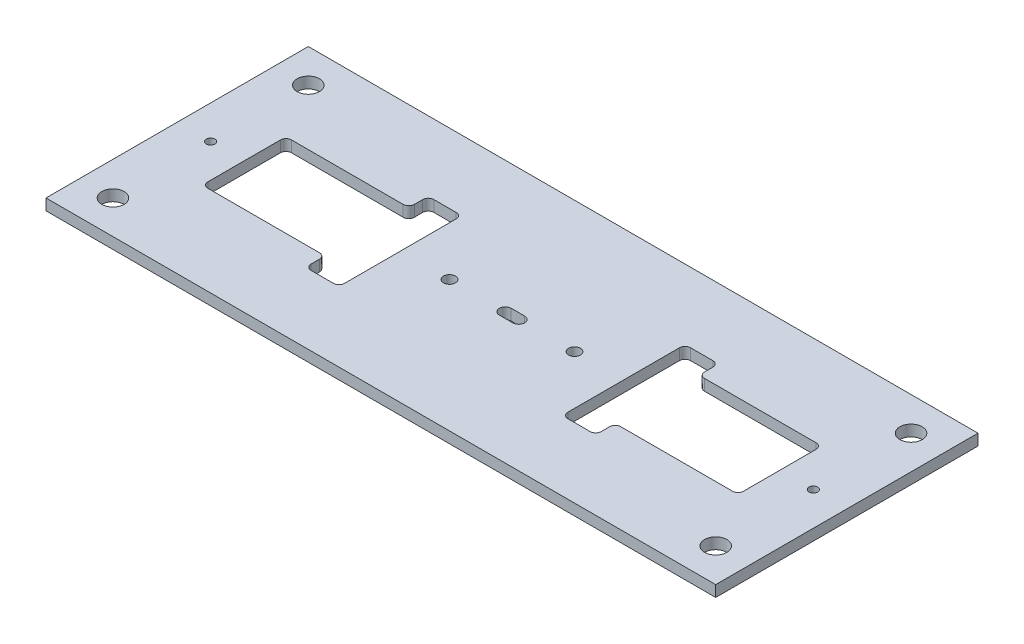
from build123d import *

# Parameters (mm, degrees)
SKETCH1_W                    = 381
SKETCH1_H                    = 149.225
BOSS_EXTRUDE1_DEPTH          = 6.35
F_1_4_CLEARANCE_HOLE1_D      = 6.7564
CUT_EXTRUDE1_DEPTH           = 410.23028129
F_1_2_0_5_DIAMETER_HOLE1_D   = 12.7
F_10_0_1935_DIAMETER_HOLE1_D = 4.9149
SKETCH9_W                    = 19.05
SKETCH9_H                    = 14.2875
CUT_EXTRUDE2_DEPTH           = 410.23028129
FILLET1_R                    = 3.175


with BuildPart() as part:
    # Sketch1 → Boss-Extrude1 (new body)
    with BuildSketch(Plane(origin=(0, 0, 0), x_dir=(1, 0, 0), z_dir=(0, 1, 0))):
        with Locations((190.5, 74.6125)):
            Rectangle(SKETCH1_W, SKETCH1_H)
        with BuildLine():
            Line((342.9, 95.25), (342.9, 53.975))
            ThreePointArc((342.9, 53.975), (341.97006403, 51.72993597), (339.725, 50.8))
            Line((339.725, 50.8), (257.175, 50.8))
            ThreePointArc((257.175, 50.8), (254.92993597, 51.72993597), (254, 53.975))
            Line((254, 53.975), (254, 95.25))
            ThreePointArc((254, 95.25), (254.92993597, 97.49506403), (257.175, 98.425))
            Line((257.175, 98.425), (339.725, 98.425))
            ThreePointArc((339.725, 98.425), (341.97006403, 97.49506403), (342.9, 95.25))
        make_face(mode=Mode.SUBTRACT)
        with BuildLine():
            Line((41.275, 98.425), (123.825, 98.425))
            ThreePointArc((123.825, 98.425), (126.07006403, 97.49506403), (127, 95.25))
            Line((127, 95.25), (127, 53.975))
            ThreePointArc((127, 53.975), (126.07006403, 51.72993597), (123.825, 50.8))
            Line((123.825, 50.8), (41.275, 50.8))
            ThreePointArc((41.275, 50.8), (39.02993597, 51.72993597), (38.1, 53.975))
            Line((38.1, 53.975), (38.1, 95.25))
            ThreePointArc((38.1, 95.25), (39.02993597, 97.49506403), (41.275, 98.425))
        make_face(mode=Mode.SUBTRACT)
    extrude(amount=BOSS_EXTRUDE1_DEPTH)

    # 1/4 Clearance Hole1 (through all)
    with Locations(Plane(origin=(0, 6.35, 0), x_dir=(1, 0, 0), z_dir=(0, 1, 0))):
        with Locations((154.94, 74.6125), (186.69, 74.6125), (194.31, 74.6125), (226.06, 74.6125)):
            Hole(F_1_4_CLEARANCE_HOLE1_D / 2)

    # Sketch4 → Cut-Extrude1 (cut, through all)
    with BuildSketch(Plane(origin=(0, 6.35, 0), x_dir=(1, 0, 0), z_dir=(0, 1, 0))):
        with BuildLine():
            Line((186.69, 77.9907), (194.31, 77.9907))
            ThreePointArc((194.31, 77.9907), (197.6882, 74.6125), (194.31, 71.2343))
            Line((194.31, 71.2343), (186.69, 71.2343))
            ThreePointArc((186.69, 71.2343), (183.3118, 74.6125), (186.69, 77.9907))
        make_face()
    extrude(amount=-CUT_EXTRUDE1_DEPTH, mode=Mode.SUBTRACT)

    # 1/2 (0.5) Diameter Hole1 (through all)
    with Locations(Plane(origin=(19.05, 6.35, -130.175), x_dir=(0, 0, 1), z_dir=(0, 1, 0))):
        with Locations((0, 0), (111.125, 0), (0, 342.9), (111.125, 342.9)):
            Hole(F_1_2_0_5_DIAMETER_HOLE1_D / 2)

    # #10 (0.1935) Diameter Hole1 (through all)
    with Locations(Plane(origin=(0, 6.35, 0), x_dir=(1, 0, 0), z_dir=(0, 1, 0))):
        with Locations((19.05, 74.6125), (361.95, 74.6125)):
            Hole(F_10_0_1935_DIAMETER_HOLE1_D / 2)

    # Sketch9 → Cut-Extrude2 (cut, through all)
    with BuildSketch(Plane(origin=(0, 6.35, 0), x_dir=(1, 0, 0), z_dir=(0, 1, 0))):
        with Locations((117.475, 102.39375)):
            Rectangle(SKETCH9_W, SKETCH9_H)
        with Locations((117.475, 46.83125)):
            Rectangle(SKETCH9_W, SKETCH9_H)
        with Locations((263.525, 46.83125)):
            Rectangle(SKETCH9_W, SKETCH9_H)
        with Locations((263.525, 102.39375)):
            Rectangle(SKETCH9_W, SKETCH9_H)
    extrude(amount=-CUT_EXTRUDE2_DEPTH, mode=Mode.SUBTRACT)

    # Fillet1
    fillet1_edges = [part.edges().sort_by_distance(p)[0] for p in [
        (273.05, 3.175, -50.8),
        (273.05, 3.175, -98.425),
        (107.95, 3.175, -98.425),
        (107.95, 3.175, -50.8),
        (273.05, 3.175, -109.5375),
        (254, 3.175, -109.5375),
        (273.05, 3.175, -39.6875),
        (254, 3.175, -39.6875),
        (107.95, 3.175, -39.6875),
        (127, 3.175, -39.6875),
        (107.95, 3.175, -109.5375),
        (127, 3.175, -109.5375),
    ]]
    fillet(fillet1_edges, radius=FILLET1_R)


solid = part.part
